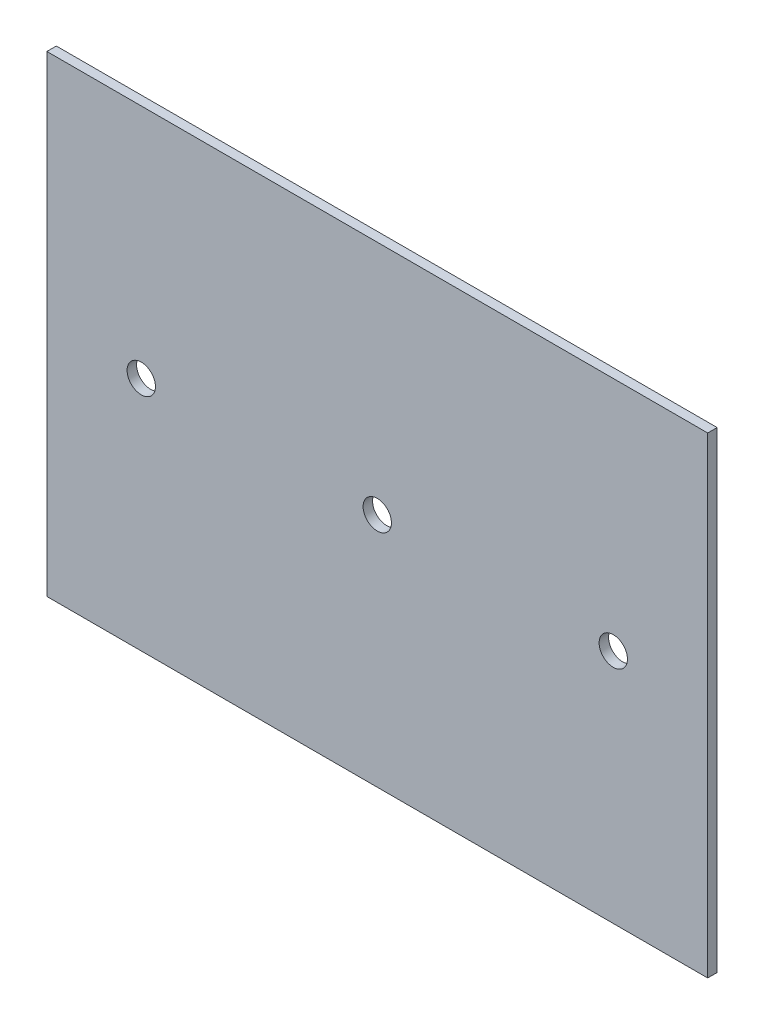
from build123d import *

# Parameters (mm, degrees)
CROQUIS1_W              = 70
CROQUIS1_H              = 50
SALIENTE_EXTRUIR1_DEPTH = 1
CROQUIS2_R              = 1.5
CORTAR_EXTRUIR1_DEPTH   = 1


with BuildPart() as part:
    # Croquis1 → Saliente-Extruir1 (new body)
    with BuildSketch(Plane.XY):
        Rectangle(CROQUIS1_W, CROQUIS1_H)
    extrude(amount=SALIENTE_EXTRUIR1_DEPTH)

    # Croquis2 → Cortar-Extruir1 (cut)
    with BuildSketch(Plane(origin=(0, 0, 0), x_dir=(-1, 0, 0), z_dir=(0, 0, -1))):
        with Locations((-25, 0)):
            Circle(CROQUIS2_R)
        Circle(CROQUIS2_R)
        with Locations((25, 0)):
            Circle(CROQUIS2_R)
    extrude(amount=-CORTAR_EXTRUIR1_DEPTH, mode=Mode.SUBTRACT)


solid = part.part
